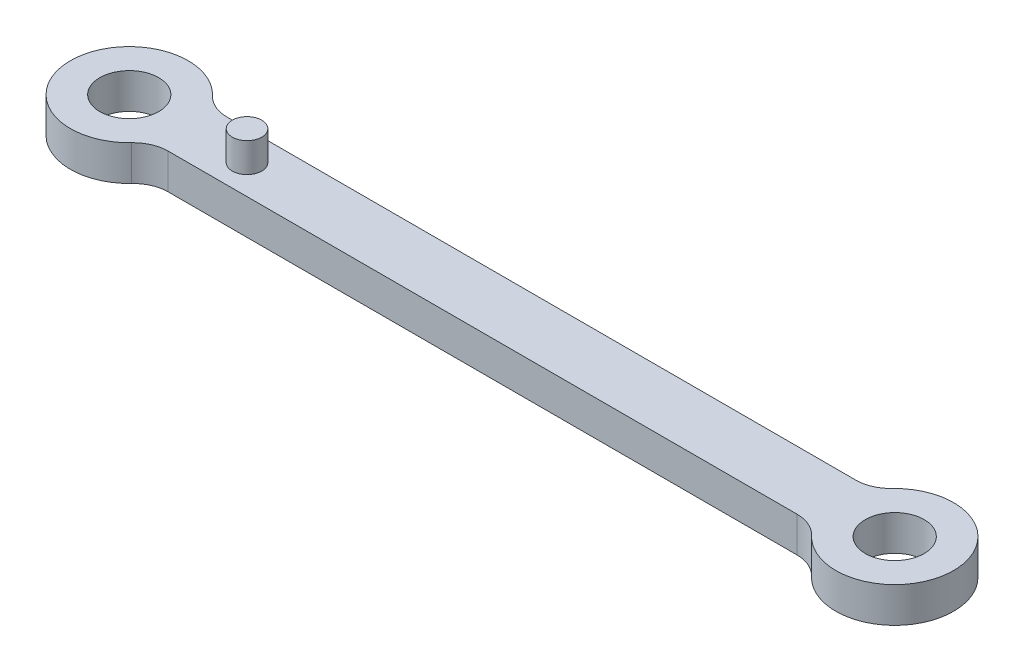
from build123d import *

# Parameters (mm, degrees)
EXTRUDE_1_DEPTH     = 6
FILLET_1_R          = 6
SKETCH_2_R          = 5
CUT_EXTRUDE_1_DEPTH = 6
SKETCH_3_R          = 2.5
EXTRUDE_2_DEPTH     = 5


with BuildPart() as part:
    # 草图1 → 凸台-拉伸1 (new body)
    with BuildSketch(Plane(origin=(0, 0, 0), x_dir=(1, 0, 0), z_dir=(0, 1, 0))):
        with BuildLine():
            Line((0, 5), (0, 0))
            Line((0, 0), (0, -5))
            Line((0, -5), (8.660254038, -5))
            ThreePointArc((8.660254038, -5), (9.659258263, -2.588190451), (10, 0))
            ThreePointArc((10, 0), (9.659258263, 2.588190451), (8.660254038, 5))
            Line((8.660254038, 5), (0, 5))
        make_face()
        with BuildLine():
            Line((0, -5), (0, 0))
            Line((0, 0), (0, 5))
            Line((0, 5), (8.660254038, 5))
            ThreePointArc((8.660254038, 5), (-10, 0), (8.660254038, -5))
            Line((8.660254038, -5), (0, -5))
        make_face()
        with BuildLine():
            ThreePointArc((10, 0), (9.659258263, -2.588190451), (8.660254038, -5))
            Line((8.660254038, -5), (121.339745962, -5))
            ThreePointArc((121.339745962, -5), (120, 0), (121.339745962, 5))
            Line((121.339745962, 5), (8.660254038, 5))
            ThreePointArc((8.660254038, 5), (9.659258263, 2.588190451), (10, 0))
        make_face()
        with BuildLine():
            Line((0, 5), (0, 0))
            Line((0, 0), (0, -5))
            Line((0, -5), (8.660254038, -5))
            ThreePointArc((8.660254038, -5), (9.659258263, -2.588190451), (10, 0))
            ThreePointArc((10, 0), (9.659258263, 2.588190451), (8.660254038, 5))
            Line((8.660254038, 5), (0, 5))
        make_face()
        with BuildLine():
            Line((0, -5), (0, 0))
            Line((0, 0), (0, 5))
            Line((0, 5), (8.660254038, 5))
            ThreePointArc((8.660254038, 5), (-10, 0), (8.660254038, -5))
            Line((8.660254038, -5), (0, -5))
        make_face()
        with BuildLine():
            ThreePointArc((121.339745962, 5), (120, 0), (121.339745962, -5))
            Line((121.339745962, -5), (130, -5))
            Line((130, -5), (130, 5))
            Line((130, 5), (121.339745962, 5))
        make_face()
        with BuildLine():
            Line((130, -5), (121.339745962, -5))
            ThreePointArc((121.339745962, -5), (132.588190451, -9.659258263), (140, 0))
            ThreePointArc((140, 0), (132.588190451, 9.659258263), (121.339745962, 5))
            Line((121.339745962, 5), (130, 5))
            Line((130, 5), (130, -5))
        make_face()
        with BuildLine():
            ThreePointArc((121.339745962, 5), (120, 0), (121.339745962, -5))
            Line((121.339745962, -5), (130, -5))
            Line((130, -5), (130, 5))
            Line((130, 5), (121.339745962, 5))
        make_face()
        with BuildLine():
            Line((130, -5), (121.339745962, -5))
            ThreePointArc((121.339745962, -5), (132.588190451, -9.659258263), (140, 0))
            ThreePointArc((140, 0), (132.588190451, 9.659258263), (121.339745962, 5))
            Line((121.339745962, 5), (130, 5))
            Line((130, 5), (130, -5))
        make_face()
    extrude(amount=EXTRUDE_1_DEPTH)

    # 圆角1
    fillet_1_edges = [part.edges().sort_by_distance(p)[0] for p in [
        (8.660254038, 3, -5),
        (121.339745962, 3, -5),
        (121.339745962, 3, 5),
        (8.660254038, 3, 5),
    ]]
    fillet(fillet_1_edges, radius=FILLET_1_R)

    # 草图2 → 切除-拉伸1 (cut)
    with BuildSketch(Plane(origin=(0, 6, 0), x_dir=(1, 0, 0), z_dir=(0, 1, 0))):
        with Locations(Location((0, 0, 0), (0, 0, 270))):
            Circle(SKETCH_2_R)
        with Locations(Location((130, 0, 0), (0, 0, 270))):
            Circle(SKETCH_2_R)
    extrude(amount=-CUT_EXTRUDE_1_DEPTH, mode=Mode.SUBTRACT)

    # 草图3 → 凸台-拉伸2 (add)
    with BuildSketch(Plane(origin=(0, 6, 0), x_dir=(1, 0, 0), z_dir=(0, 1, 0))):
        with Locations(Location((20, 0, 0), (0, 0, 270))):
            Circle(SKETCH_3_R)
    extrude(amount=EXTRUDE_2_DEPTH)


solid = part.part
